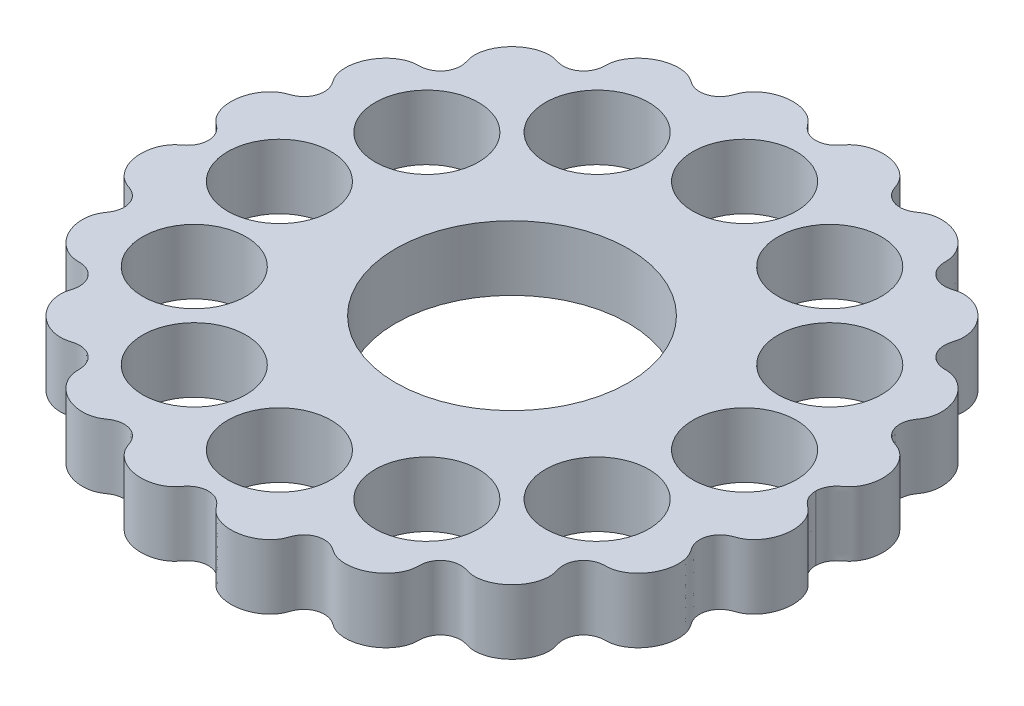
from build123d import *

# Parameters (mm, degrees)
BOSS_EXTRUDE1_DEPTH = 5
SKETCH2_R           = 9
CUT_EXTRUDE1_DEPTH  = 37.023255457
SKETCH3_R           = 4
CUT_EXTRUDE2_DEPTH  = 37.023255457


with BuildPart() as part:
    # Sketch1 → Boss-Extrude1 (new body)
    with BuildSketch(Plane(origin=(0, 0, 0), x_dir=(1, 0, 0), z_dir=(0, 1, 0))):
        with BuildLine():
            Line((23.500053739, 0.012949448), (23.5, 0))
            add(Edge.make_bspline(
                [(23.5, 0), (23.5, -0.014453172), (23.50048508, -0.043504388), (23.50339551, -0.114029789), (23.513569445, -0.22198651), (23.530955918, -0.317091038), (23.555429075, -0.416440572), (23.585459272, -0.512940394), (23.620945297, -0.607613227), (23.684181266, -0.74560023), (23.798478643, -0.935661778), (23.94699105, -1.113622795), (24.12642864, -1.274278891), (24.333525392, -1.429445467), (24.532369538, -1.596723416), (24.758781486, -1.861647123), (24.978485736, -2.239002292), (25.187764436, -2.815567065), (25.275956973, -3.601959201), (25.151220003, -4.386443064), (24.825036119, -5.104600794), (24.451202595, -5.58517294), (24.160259947, -5.847186967), (23.905442466, -6.013056094), (23.710583223, -6.109183821), (23.548415786, -6.171719972), (23.34341009, -6.242384033), (23.119511411, -6.340122775), (22.889598803, -6.485167398), (22.619090698, -6.735753814), (22.386623934, -7.084056154), (22.265243184, -7.485049995), (22.264165999, -7.896683598), (22.332277406, -8.200545774), (22.410551002, -8.406257848), (22.5008602, -8.580121661), (22.592373869, -8.72591281), (22.716330215, -8.901235243), (22.849571679, -9.123058365), (22.978446684, -9.444725007), (23.066224686, -9.869865142), (23.079044776, -10.34835197), (23.001419722, -10.864748975), (22.798838253, -11.486313832), (22.466786078, -12.053882225), (22.019687074, -12.53823854), (21.510060116, -12.878311962), (21.148745905, -13.035229292), (20.852607345, -13.111170027), (20.63613906, -13.139568846), (20.461749259, -13.146885481), (20.243869221, -13.151846527), (19.92923093, -13.187395141), (19.531605751, -13.319108009), (19.114217102, -13.624189611), (18.841303425, -14.039545809), (18.723315416, -14.440600954), (18.702281815, -14.792796796), (18.731018809, -15.04738251), (18.786209948, -15.267520868), (18.856125394, -15.494821587), (18.909090192, -15.727402489), (18.929775956, -15.992782826), (18.913156591, -16.285089924), (18.853458738, -16.626947835), (18.692128146, -17.138076448), (18.324513638, -17.783745312), (17.743933857, -18.355654032), (17.092405671, -18.713032985), (16.578409626, -18.865394382), (16.231790956, -18.918890173), (15.973282329, -18.927672937), (15.740726578, -18.907740904), (15.537212688, -18.866132836), (15.377608548, -18.820139019), (15.178581857, -18.761666609), (14.943008716, -18.714427943), (14.669811472, -18.701532976), (14.293793106, -18.755056351), (13.891159014, -18.920172055), (13.559132616, -19.196830635), (13.329048416, -19.549477645), (13.207702544, -19.877262613), (13.160727116, -20.127168205), (13.148360237, -20.352331734), (13.143928242, -20.589269832), (13.118906177, -20.825630313), (13.053911192, -21.082468579), (12.945559644, -21.352921291), (12.781558387, -21.656461425), (12.469200784, -22.08780503), (11.918031059, -22.585216888), (11.186209034, -22.946867205), (10.45241426, -23.081727949), (9.911471842, -23.062991086), (9.560211968, -23.001988026), (9.306730899, -22.924979008), (9.087082889, -22.826913471), (8.865177703, -22.693065201), (8.656272154, -22.540531919), (8.404139406, -22.400706132), (8.103481562, -22.302089598), (7.734157037, -22.254686282), (7.314604068, -22.301777867), (6.928247498, -22.469200992), (6.613191708, -22.734694146), (6.425985621, -22.980326486), (6.31961161, -23.169456863), (6.226048916, -23.384282409), (6.161549581, -23.583441947), (6.080915127, -23.777390563), (5.956520315, -23.996074488), (5.784047137, -24.235468959), (5.518399216, -24.509113618), (5.038754952, -24.860517144), (4.315224553, -25.170700146), (3.521740467, -25.27964341), (2.791048105, -25.178619683), (2.280370988, -24.988846174), (1.964645284, -24.818427451), (1.747579984, -24.663608048), (1.570031065, -24.499094572), (1.430065727, -24.332934965), (1.325825185, -24.194362853), (1.187934208, -24.026693972), (1.011591069, -23.855454105), (0.786516113, -23.697740781), (0.444481728, -23.544769621), (0.027805694, -23.469358456), (-0.390595941, -23.519259802), (-0.768064317, -23.683107004), (-1.01671831, -23.863273242), (-1.172555187, -24.012299492), (-1.296785622, -24.157286107), (-1.397134182, -24.289523822), (-1.500938493, -24.419484962), (-1.615311454, -24.54032835), (-1.770635813, -24.678524908), (-2.008916437, -24.84880862), (-2.345238415, -25.022749757), (-2.786746287, -25.164786974), (-3.2883024, -25.236436118), (-3.805144186, -25.227147944), (-4.324275896, -25.133648144), (-4.831112163, -24.952540838), (-5.248250498, -24.714320707), (-5.56869613, -24.45671969), (-5.815552431, -24.193301954), (-5.972753273, -23.976065387), (-6.088667317, -23.762019134), (-6.168088978, -23.5586795), (-6.224861089, -23.393900377), (-6.307051247, -23.191716286), (-6.426140652, -22.975038881), (-6.596657041, -22.757276174), (-6.881762148, -22.510230081), (-7.257031617, -22.319406775), (-7.66639092, -22.246981865), (-8.066918824, -22.291331449), (-8.351334208, -22.38550722), (-8.54430671, -22.479509034), (-8.709495316, -22.581413924), (-8.851347164, -22.680775339), (-9.033734688, -22.79855537), (-9.268565926, -22.912247461), (-9.593495591, -23.015841151), (-10.010455886, -23.075992215), (-10.468126851, -23.06706918), (-10.953660122, -22.976956545), (-11.554398726, -22.765025041), (-12.109218653, -22.425301616), (-12.537808223, -22.012884131), (-12.834942494, -21.569986035), (-12.991740232, -21.249858163), (-13.079154794, -20.995674439), (-13.129109441, -20.753221248), (-13.145646117, -20.528137839), (-13.148480628, -20.347960654), (-13.15982308, -20.167866357), (-13.187117601, -19.989317793), (-13.239787523, -19.785944083), (-13.330141599, -19.563464291), (-13.509930846, -19.26878275), (-13.821725898, -18.965874617), (-14.204369888, -18.773435992), (-14.612263186, -18.701805781), (-14.953865965, -18.715589384), (-15.239226209, -18.772527905), (-15.527451663, -18.872328387), (-15.84389016, -18.924531498), (-16.210960497, -18.926196052), (-16.620743296, -18.861409896), (-17.059139786, -18.715213909), (-17.507916376, -18.47511691), (-17.919648084, -18.160908904), (-18.282366273, -17.778329029), (-18.582645185, -17.33359288), (-18.777031868, -16.897083111), (-18.882555935, -16.501943976), (-18.925801572, -16.145829434), (-18.924205011, -15.879796102), (-18.89198961, -15.640478966), (-18.825390811, -15.389939801), (-18.748148108, -15.142621185), (-18.701431582, -14.851366689), (-18.71348723, -14.522538537), (-18.807342842, -14.136357155), (-18.988601065, -13.803755259), (-19.239288525, -13.537281266), (-19.5326565, -13.346750498), (-19.770622477, -13.242321664), (-20.036167358, -13.172923386), (-20.28416198, -13.148202782), (-20.507487907, -13.147592384), (-20.744943241, -13.128778989), (-20.979153494, -13.083368567), (-21.287826875, -12.980992278), (-21.653475445, -12.790627052), (-22.122329053, -12.439539019), (-22.541028994, -11.946941893), (-22.85159494, -11.368132839), (-23.032551681, -10.728544915), (-23.080221801, -10.250414662), (-23.055654132, -9.839768437), (-22.992030707, -9.529027682), (-22.924886904, -9.315617222), (-22.846736537, -9.13293653), (-22.764719858, -8.979587251), (-22.644614326, -8.798763382), (-22.495898327, -8.584834917), (-22.364825838, -8.318622734), (-22.27993049, -7.998665717), (-22.257623711, -7.599295324), (-22.335706527, -7.227015417), (-22.499493568, -6.89936691), (-22.725203988, -6.633032808), (-22.921049262, -6.46568657), (-23.119245086, -6.343724136), (-23.30807183, -6.257592321), (-23.479536037, -6.195065794), (-23.628358693, -6.142269261), (-23.809741133, -6.064052343), (-24.015940868, -5.946386501), (-24.274347908, -5.751904528), (-24.559110496, -5.457159692), (-24.891246677, -4.979089706), (-25.133434861, -4.382418971), (-25.247200773, -3.736419674), (-25.218943318, -3.071652659), (-25.113495808, -2.600157157), (-24.959846421, -2.21612702), (-24.800184001, -1.940033543), (-24.667864323, -1.758135822), (-24.534728335, -1.609148376), (-24.407038842, -1.489719304), (-24.269377861, -1.382339681), (-24.131058347, -1.275755042), (-23.967522334, -1.130989022), (-23.799658534, -0.940838069), (-23.647411101, -0.694957487), (-23.509254026, -0.317086663), (-23.472879519, 0.107405063), (-23.556269012, 0.501069864), (-23.727042578, 0.83233763), (-23.889376188, 1.045598041), (-24.039318411, 1.198963836), (-24.204780762, 1.334822739), (-24.376509488, 1.462339675), (-24.549702282, 1.620374876), (-24.714635799, 1.814079479), (-24.865492194, 2.043400673), (-24.996575079, 2.306997925), (-25.123246745, 2.652390811), (-25.21748013, 3.084504906), (-25.251831251, 3.703930886), (-25.138192023, 4.369081476), (-24.893689435, 4.97410649), (-24.563231357, 5.451952036), (-24.27978208, 5.746931379), (-24.022463318, 5.941969743), (-23.817033791, 6.060309315), (-23.636239425, 6.139214986), (-23.487722029, 6.192269887), (-23.316444075, 6.254227113), (-23.12767498, 6.339275492), (-22.929335588, 6.459769671), (-22.733000405, 6.625339418), (-22.505571631, 6.889854127), (-22.339351851, 7.216390511), (-22.258546819, 7.588580742), (-22.278329484, 7.988893626), (-22.361504372, 8.309961873), (-22.49147674, 8.577343652), (-22.639761766, 8.79215805), (-22.760688009, 8.97286006), (-22.843476123, 9.126143275), (-22.922431231, 9.308859449), (-22.990369343, 9.522434825), (-23.054940032, 9.833558871), (-23.080439398, 10.244886359), (-23.033499005, 10.723957562), (-22.853319152, 11.363996414), (-22.543638358, 11.942950039), (-22.1262308, 12.435552107), (-21.659079686, 12.786959761), (-21.294665779, 12.977939741), (-20.98691277, 13.081239594), (-20.753306352, 13.127510321), (-20.516303586, 13.147459422), (-20.293420761, 13.147908279), (-20.045895873, 13.17127565), (-19.780586074, 13.238972874), (-19.542582819, 13.341492528), (-19.248001198, 13.529784716), (-18.995231235, 13.794502636), (-18.81135541, 14.126279239), (-18.714800717, 14.512661018), (-18.700796642, 14.842051403), (-18.746109294, 15.134102393), (-18.822794015, 15.382070795), (-18.890506788, 15.632727141), (-18.923747672, 15.87234108), (-18.926219026, 16.138839295), (-18.883864009, 16.495722058), (-18.77900714, 16.891824102), (-18.585009437, 17.329492386), (-18.285043142, 17.775024732), (-17.922801913, 18.158033075), (-17.511943338, 18.472418141), (-17.064518402, 18.712821951), (-16.627392731, 18.859605017), (-16.218592769, 18.92554207), (-15.852311521, 18.925030785), (-15.536116872, 18.874740806), (-15.248320734, 18.775426949), (-14.964056746, 18.716865759), (-14.688485696, 18.704086935), (-14.428894771, 18.733808575), (-14.092096863, 18.829612328), (-13.77449955, 19.010403027), (-13.504082002, 19.273960613), (-13.301029331, 19.613503894), (-13.192163762, 19.922605286), (-13.149914439, 20.213340415), (-13.148308379, 20.47151014), (-13.13196467, 20.729421848), (-13.086856553, 20.965719982), (-13.004685408, 21.217736965), (-12.852301142, 21.540922957), (-12.554645514, 21.995366046), (-12.122339098, 22.416439962), (-11.562589988, 22.761557976), (-10.958236342, 22.975654833), (-10.473877304, 23.066397814), (-10.017194865, 23.07628575), (-9.600967068, 23.017419479), (-9.276381256, 22.915205454), (-9.041551953, 22.802837153), (-8.859023488, 22.686119572), (-8.717549651, 22.586857826), (-8.553196848, 22.484456109), (-8.361187737, 22.389558978), (-8.078030358, 22.293731577), (-7.674047362, 22.24600021), (-7.257963151, 22.317823251), (-6.87502334, 22.513220545), (-6.583402896, 22.770369735), (-6.410884042, 22.997260991), (-6.292185376, 23.222690573), (-6.211071265, 23.432309073), (-6.152783773, 23.602148783), (-6.065796615, 23.809615455), (-5.942092024, 24.022940424), (-5.779549898, 24.235753913), (-5.531052704, 24.489345458), (-5.111821093, 24.815475408), (-4.577224919, 25.072884799), (-3.944726523, 25.222680837), (-3.307305153, 25.236854455), (-2.815773576, 25.170503317), (-2.376371545, 25.034948693), (-2.036924193, 24.865410853), (-1.791601105, 24.695387843), (-1.627280247, 24.55218915), (-1.506364536, 24.426277993), (-1.397466321, 24.2900968), (-1.292348505, 24.151301911), (-1.164695899, 24.0038844), (-1.007675216, 23.856083151), (-0.762724694, 23.681251597), (-0.392560705, 23.520835245), (0.019778151, 23.46979397), (0.433678419, 23.541547769), (0.777494194, 23.692554286), (1.003996453, 23.849211493), (1.181596507, 24.019829812), (1.32036927, 24.187267209), (1.424784514, 24.326067771), (1.564234384, 24.493114821), (1.741412262, 24.658672265), (1.958362818, 24.814529165), (2.274218442, 24.9861782), (2.785532447, 25.177516943), (3.389538299, 25.261999423), (4.055015229, 25.206628672), (4.68059079, 25.013842392), (5.136610832, 24.788086602), (5.513123302, 24.513548108), (5.778870577, 24.241287931), (5.951919475, 24.003173981), (6.055875215, 23.821803685), (6.126098762, 23.669976163), (6.183779605, 23.513024504), (6.239250391, 23.355605204), (6.31476074, 23.179187463), (6.419800627, 22.989814131), (6.604920009, 22.743289233), (6.917839247, 22.475507377), (7.303008744, 22.30501051), (7.722593046, 22.254735025), (8.093031142, 22.299645714), (8.394865307, 22.396622379), (8.648379174, 22.535280336), (8.857862629, 22.687870335), (9.07950215, 22.823067828), (9.299204502, 22.922226137), (9.552931853, 23.000278425), (9.904737872, 23.062400253), (10.44680347, 23.082418165), (11.044507215, 22.973551396), (11.6583459, 22.7131309), (12.192782891, 22.3338235), (12.557224498, 21.97394075), (12.829667682, 21.591972477), (12.996552849, 21.246898528), (13.084807951, 20.963719065), (13.133623664, 20.71532355), (13.147809875, 20.504575583), (13.148230836, 20.293973772), (13.173574894, 20.059751573), (13.219343871, 19.846706822), (13.326204651, 19.555801197), (13.552988735, 19.203968633), (13.88204362, 18.926002472), (14.282864166, 18.758135598), (14.659433996, 18.701961859), (14.933281748, 18.713261513), (15.169583428, 18.759406782), (15.369116158, 18.817496367), (15.528849053, 18.864027174), (15.732530138, 18.906628925), (15.965436745, 18.927531567), (16.224479495, 18.919590757), (16.571928143, 18.866955171), (17.087354857, 18.715426025), (17.739821619, 18.358870945), (18.3212789, 17.787762514), (18.72304306, 17.084571588), (18.892097782, 16.492237235), (18.93486871, 16.067218013), (18.910113273, 15.735499123), (18.858441548, 15.502918131), (18.788708429, 15.275856404), (18.732679857, 15.05641641), (18.702667414, 14.802611786), (18.721459563, 14.451336586), (18.836368817, 14.050025337), (19.06694835, 13.693277104), (19.391916258, 13.420509073), (19.72590556, 13.255076985), (19.990174012, 13.181302478), (20.234823917, 13.152382043), (20.453007623, 13.146988785), (20.627706077, 13.140277187), (20.844621651, 13.112775013), (21.078053637, 13.053912124), (21.322970402, 12.959701479), (21.632066542, 12.796750567), (22.060448879, 12.493596667), (22.553034148, 11.961642425), (22.918105684, 11.256348744), (23.081801653, 10.484797241), (23.066863779, 9.876892121), (22.980587346, 9.452274785), (22.853146259, 9.130694257), (22.721260374, 8.908458434), (22.572706812, 8.698328201), (22.448425949, 8.494448558), (22.344966169, 8.25232344), (22.265370859, 7.907792345), (22.263436162, 7.496614197), (22.381749077, 7.094708218), (22.611897869, 6.744324728), (22.881477171, 6.491302644), (23.111079715, 6.344617054), (23.334953017, 6.245580421), (23.540172083, 6.174539996), (23.702824317, 6.112578008), (23.898375614, 6.017150626), (24.099590667, 5.88730615), (24.300602905, 5.720973402), (24.540681162, 5.469944121), (24.772295718, 5.154925118), (24.985810021, 4.751106736), (25.191674082, 4.130725136), (25.261278453, 3.476598637), (25.188821944, 2.82128887), (24.981327617, 2.245418664), (24.763195455, 1.868129693), (24.538231592, 1.602802235), (24.340546557, 1.43473461), (24.133607355, 1.279942438), (23.95372418, 1.12062896), (23.804530596, 0.943733958), (23.689280027, 0.755092327), (23.618183023, 0.602381537), (23.57187255, 0.476929532), (23.536458402, 0.344902682), (23.515378462, 0.234097676), (23.504371835, 0.126536931), (23.500895901, 0.056318771), (23.500173338, 0.027359101), (23.500053739, 0.012949448)],
                knots=[0.070931981, 0.070931981, 0.070931981, 0.070931981, 0.070931981, 0.071249871, 0.071567761, 0.072203541, 0.072839322, 0.073157212, 0.073475102, 0.074110883, 0.074746663, 0.076018224, 0.077647562, 0.078462232, 0.079276901, 0.080906239, 0.082535578, 0.085004235, 0.087472891, 0.092410205, 0.097302015, 0.09974792, 0.102193824, 0.103831658, 0.104650575, 0.105469492, 0.106288409, 0.107107326, 0.10874516, 0.110066559, 0.111387959, 0.114030758, 0.116550169, 0.117809875, 0.11906958, 0.119880615, 0.120691649, 0.121502683, 0.122313717, 0.123935785, 0.125557854, 0.12801012, 0.130462387, 0.132914654, 0.135366921, 0.1402903, 0.14275199, 0.145213679, 0.146859202, 0.147681964, 0.148504726, 0.149327487, 0.150150249, 0.151795772, 0.154462483, 0.157129193, 0.159694751, 0.16097753, 0.162260309, 0.163756951, 0.164505272, 0.165253592, 0.166750234, 0.168246876, 0.169506512, 0.170766148, 0.173285421, 0.178323966, 0.183362795, 0.18588221, 0.187141917, 0.188401624, 0.1899678, 0.190750887, 0.191533975, 0.192317063, 0.19310015, 0.194666326, 0.196056645, 0.197446964, 0.200227602, 0.202765612, 0.204034618, 0.205303623, 0.20679466, 0.207540178, 0.208285697, 0.209776734, 0.211267771, 0.212519462, 0.213771152, 0.216274534, 0.221281297, 0.226368058, 0.228911439, 0.230183129, 0.231454819, 0.233082034, 0.233895642, 0.234709249, 0.236336464, 0.237963679, 0.239304003, 0.240644326, 0.243324974, 0.24583059, 0.247083398, 0.248336205, 0.249126444, 0.249916683, 0.251497161, 0.2522874, 0.253077638, 0.254658116, 0.257053073, 0.25944803, 0.264237943, 0.269357271, 0.271916935, 0.273196767, 0.274476599, 0.276113729, 0.276932294, 0.277750859, 0.278569425, 0.27938799, 0.28102512, 0.282373933, 0.283722745, 0.286420371, 0.288913091, 0.290159452, 0.291405812, 0.292189623, 0.292973434, 0.293757246, 0.294541057, 0.295324868, 0.296108679, 0.297676301, 0.300055878, 0.302435454, 0.30481503, 0.307194607, 0.309770443, 0.312346278, 0.314922114, 0.316210032, 0.31749795, 0.319143423, 0.31996616, 0.320788897, 0.321611633, 0.32243437, 0.324079843, 0.325438421, 0.326796999, 0.329514155, 0.331920533, 0.333123722, 0.334326912, 0.335144888, 0.335962865, 0.336780842, 0.337598819, 0.339234773, 0.340870726, 0.343190796, 0.345510865, 0.347830934, 0.350151004, 0.355163495, 0.357669741, 0.358922864, 0.360175987, 0.361876987, 0.362727487, 0.363577987, 0.364428487, 0.365278987, 0.366129487, 0.366979987, 0.3683865, 0.369793014, 0.372606041, 0.375066592, 0.376296868, 0.377527143, 0.379032033, 0.380536924, 0.382041814, 0.383546704, 0.385937039, 0.388327373, 0.390717708, 0.393108043, 0.395670367, 0.398232692, 0.400795017, 0.402076179, 0.403357341, 0.404986866, 0.405801628, 0.406616391, 0.408245916, 0.409875441, 0.411330685, 0.412785929, 0.415696418, 0.416917099, 0.41813778, 0.419358461, 0.420579141, 0.422075871, 0.422824236, 0.423572601, 0.425069331, 0.426566062, 0.428940887, 0.431315713, 0.436065364, 0.438642107, 0.441218851, 0.443795595, 0.445083967, 0.446372339, 0.44719139, 0.448010442, 0.448829493, 0.449648545, 0.451286648, 0.452924752, 0.454389659, 0.455854567, 0.458784382, 0.459994501, 0.46120462, 0.462414739, 0.463624859, 0.464369612, 0.465114365, 0.465859118, 0.466603872, 0.468093378, 0.469582885, 0.471942834, 0.474302784, 0.479022683, 0.48161333, 0.484203978, 0.486794626, 0.48808995, 0.489385274, 0.490208808, 0.491032342, 0.491855877, 0.492679411, 0.493502945, 0.49432648, 0.495973549, 0.497447581, 0.498921613, 0.501869677, 0.503887756, 0.504896796, 0.505905835, 0.506914875, 0.507923915, 0.508932954, 0.509941994, 0.511327692, 0.51271339, 0.514099088, 0.515484786, 0.518256182, 0.521027578, 0.525737932, 0.528093109, 0.530448287, 0.531935758, 0.533423229, 0.534166965, 0.534910701, 0.535654436, 0.536398172, 0.537604684, 0.538811195, 0.540017707, 0.541224219, 0.544160049, 0.545627964, 0.547095879, 0.548736839, 0.550377799, 0.551198278, 0.552018758, 0.552839238, 0.553659718, 0.554950365, 0.556241012, 0.558822305, 0.561403599, 0.563984893, 0.568724897, 0.571094899, 0.573464901, 0.574959142, 0.576453383, 0.577200504, 0.577947624, 0.579441865, 0.580659235, 0.581876606, 0.583093976, 0.584311346, 0.587228198, 0.588686623, 0.590145049, 0.591777301, 0.593409554, 0.59422568, 0.595041806, 0.596674059, 0.597957578, 0.599241097, 0.601808136, 0.604375175, 0.606942214, 0.609327522, 0.61171283, 0.614098138, 0.616483446, 0.617985543, 0.61948764, 0.620989737, 0.622491834, 0.623719119, 0.624946404, 0.626173689, 0.627400974, 0.630297772, 0.631746172, 0.633194571, 0.634818526, 0.636442481, 0.637254458, 0.638066436, 0.639690391, 0.640966533, 0.642242675, 0.644794959, 0.649899528, 0.652214793, 0.654530058, 0.656845323, 0.659160588, 0.660792998, 0.662425409, 0.663241614, 0.664057819, 0.664874025, 0.66569023, 0.666890788, 0.668091346, 0.670492462, 0.673291964, 0.674691715, 0.676091467, 0.677786577, 0.678634133, 0.679481688, 0.680329243, 0.681176799, 0.682871909, 0.684119945, 0.68536798, 0.687864051, 0.692856192, 0.69518635, 0.697516507, 0.699846665, 0.702176822, 0.703820644, 0.704642555, 0.705464466, 0.706286377, 0.707108288, 0.707930199, 0.70875211, 0.709960497, 0.711168884, 0.713585657, 0.716289593, 0.71764156, 0.718993528, 0.720633401, 0.721453338, 0.722273275, 0.723093211, 0.723913148, 0.725553021, 0.726835467, 0.728117912, 0.730682803, 0.735812584, 0.73820257, 0.740592557, 0.742982543, 0.74537253, 0.746948698, 0.747736783, 0.748524867, 0.749312951, 0.750101035, 0.75088912, 0.751677204, 0.752928045, 0.754178885, 0.756680567, 0.759366786, 0.760709895, 0.762053005, 0.763683377, 0.765313749, 0.766128935, 0.766944121, 0.768574493, 0.769848836, 0.771123179, 0.773671866, 0.778769239, 0.781174601, 0.783579962, 0.785985324, 0.788390685, 0.789980657, 0.790775643, 0.791570629, 0.793160601, 0.793955587, 0.794750573, 0.796007147, 0.797263721, 0.799776869, 0.802564378, 0.803958132, 0.805351886, 0.806920808, 0.807705268, 0.808489729, 0.80927419, 0.81005865, 0.811627572, 0.812889862, 0.814152152, 0.816676733, 0.821725894, 0.826754194, 0.829268344, 0.831782493, 0.833277241, 0.83477199, 0.835519364, 0.836266738, 0.837761486, 0.839039862, 0.840318238, 0.842874991, 0.845549231, 0.846886352, 0.848223472, 0.849871601, 0.850695665, 0.851519729, 0.852343794, 0.853167858, 0.854815987, 0.856049354, 0.857282722, 0.859749458, 0.864682929, 0.869576799, 0.872023733, 0.874470668, 0.876090526, 0.877710385, 0.878520314, 0.879330243, 0.880950101, 0.882205887, 0.883461672, 0.885973243, 0.888623869, 0.889949183, 0.891274496, 0.892914751, 0.893734879, 0.894555006, 0.895375134, 0.896195262, 0.897835517, 0.899061033, 0.900286549, 0.90273758, 0.905188612, 0.907639644, 0.912566405, 0.915029786, 0.917493167, 0.919120087, 0.920747006, 0.921560466, 0.922373926, 0.924000846, 0.925268622, 0.925902509, 0.926536397, 0.927170285, 0.927804173, 0.928438061, 0.928755005, 0.929071949, 0.929071949, 0.929071949, 0.929071949, 0.929071949], degree=4))
        make_face()
    extrude(amount=BOSS_EXTRUDE1_DEPTH)

    # Sketch2 → Cut-Extrude1 (cut, through all)
    with BuildSketch(Plane(origin=(0, 5, 0), x_dir=(1, 0, 0), z_dir=(0, 1, 0))):
        with Locations(Location((0, 0, 0), (0, 0, 270))):
            Circle(SKETCH2_R)
    extrude(amount=-CUT_EXTRUDE1_DEPTH, mode=Mode.SUBTRACT)

    # Sketch3 → Cut-Extrude2 (cut, through all)
    with BuildSketch(Plane(origin=(0, 5, 0), x_dir=(1, 0, 0), z_dir=(0, 1, 0))):
        with Locations(Location((-18, 0, 0), (0, 0, 270))):
            Circle(SKETCH3_R)
        with Locations(Location((-15.588457268, 9, 0), (0, 0, 270))):
            Circle(SKETCH3_R)
        with Locations(Location((-9, 15.588457268, 0), (0, 0, 270))):
            Circle(SKETCH3_R)
        with Locations(Location((0, 18, 0), (0, 0, 270))):
            Circle(SKETCH3_R)
        with Locations(Location((9, 15.588457268, 0), (0, 0, 270))):
            Circle(SKETCH3_R)
        with Locations(Location((15.588457268, 9, 0), (0, 0, 270))):
            Circle(SKETCH3_R)
        with Locations(Location((18, 0, 0), (0, 0, 270))):
            Circle(SKETCH3_R)
        with Locations(Location((15.588457268, -9, 0), (0, 0, 270))):
            Circle(SKETCH3_R)
        with Locations(Location((9, -15.588457268, 0), (0, 0, 270))):
            Circle(SKETCH3_R)
        with Locations(Location((0, -18, 0), (0, 0, 270))):
            Circle(SKETCH3_R)
        with Locations(Location((-9, -15.588457268, 0), (0, 0, 270))):
            Circle(SKETCH3_R)
        with Locations(Location((-15.588457268, -9, 0), (0, 0, 270))):
            Circle(SKETCH3_R)
    extrude(amount=-CUT_EXTRUDE2_DEPTH, mode=Mode.SUBTRACT)


solid = part.part
